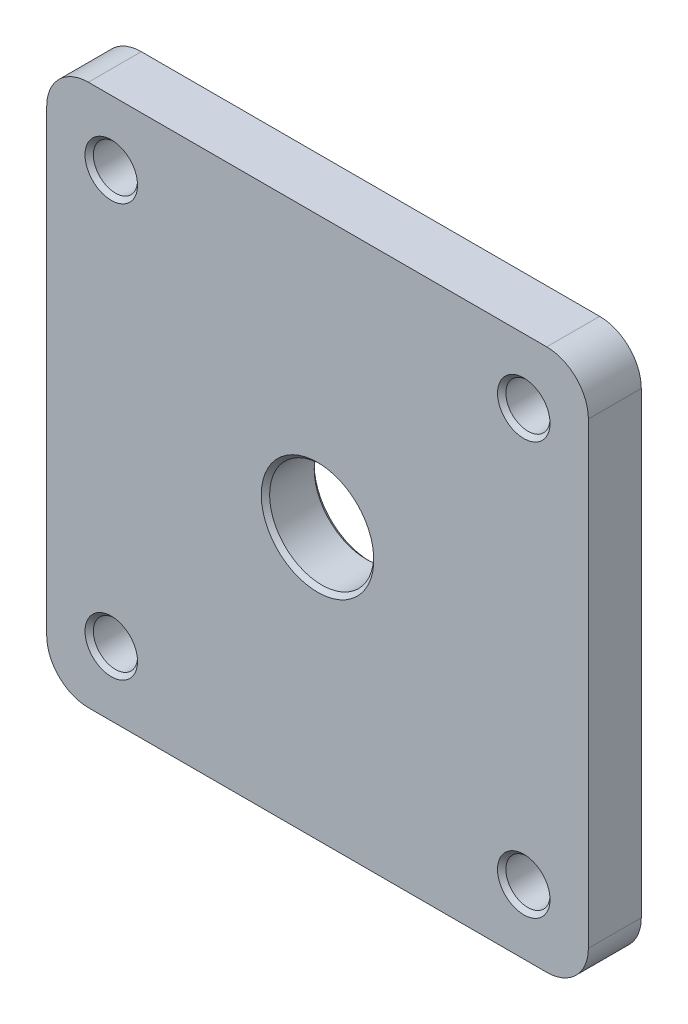
from build123d import *

# Parameters (mm, degrees)
SKETCH1_W                  = 65
SKETCH1_H                  = 65
F_1_4_IN_SHEET_METAL_DEPTH = 3.175
M12_CLEARANCE_HOLE_D       = 12.5
M5_CLEARANCE_HOLE1_D       = 5.3
FILLET1_5_MM_R             = 5
CHAMFER_0_5_MM_SIZE        = 0.5


with BuildPart() as part:
    # Sketch1 → 1/4 in Sheet Metal (new, symmetric)
    with BuildSketch(Plane.XY):
        Rectangle(SKETCH1_W, SKETCH1_H)
    extrude(amount=F_1_4_IN_SHEET_METAL_DEPTH, both=True)

    # M12 Clearance Hole (through all)
    with Locations(Plane.XY.offset(3.175)):
        with Locations((0, 0)):
            Hole(M12_CLEARANCE_HOLE_D / 2)

    # M5 Clearance Hole1 (through all)
    with Locations(Plane.XY.offset(3.175)):
        with Locations((24.748737342, 24.748737342), (-24.748737342, 24.748737342), (-24.748737342, -24.748737342), (24.748737342, -24.748737342)):
            Hole(M5_CLEARANCE_HOLE1_D / 2)

    # Fillet1 5 mm
    fillet1_5_mm_edges = [part.edges().sort_by_distance(p)[0] for p in [
        (32.5, -32.5, 0),
        (-32.5, -32.5, 0),
        (-32.5, 32.5, 0),
        (32.5, 32.5, 0),
    ]]
    fillet(fillet1_5_mm_edges, radius=FILLET1_5_MM_R)

    # Chamfer 0.5 mm
    chamfer_0_5_mm_edges = [part.edges().sort_by_distance(p)[0] for p in [
        (6.25, 0, 3.175),
        (6.25, 0, -3.175),
        (27.398737342, -24.748737342, 3.175),
        (27.398737342, -24.748737342, -3.175),
        (-22.098737342, -24.748737342, 3.175),
        (-22.098737342, -24.748737342, -3.175),
        (-22.098737342, 24.748737342, 3.175),
        (-22.098737342, 24.748737342, -3.175),
        (27.398737342, 24.748737342, 3.175),
        (27.398737342, 24.748737342, -3.175),
    ]]
    chamfer(chamfer_0_5_mm_edges, length=CHAMFER_0_5_MM_SIZE)


solid = part.part
